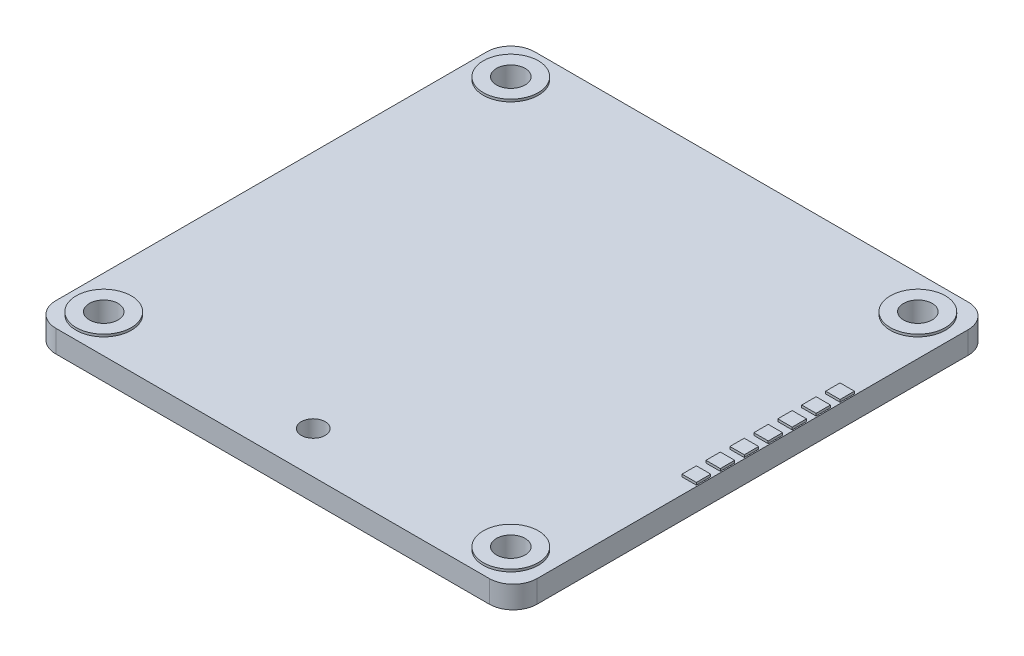
from build123d import *

# Parameters (mm, degrees)
SKETCH1_W            = 51.054
SKETCH1_H            = 50.8
BOSS_EXTRUDE1_DEPTH  = 2.3622
SKETCH5_R            = 2.921
BOSS_EXTRUDE3_DEPTH  = 0.254
SKETCH2_R            = 1.524
CUT_EXTRUDE1_DEPTH   = 73.060605776
LPATTERN1_COUNT      = 2
LPATTERN1_PITCH      = 43.18
LPATTERN1_COUNT_DIR2 = 2
LPATTERN1_PITCH_DIR2 = 43.18
FILLET1_R            = 2.54
SKETCH3_R            = 1.27
CUT_EXTRUDE2_DEPTH   = 73.060605776
SKETCH6_W            = 1.524
SKETCH6_H            = 1.524
BOSS_EXTRUDE4_DEPTH  = 0.254
LPATTERN2_COUNT      = 7
LPATTERN2_PITCH      = 2.54


with BuildPart() as part:
    # Sketch1 → Boss-Extrude1 (new body)
    with BuildSketch(Plane(origin=(0, 0, 0), x_dir=(1, 0, 0), z_dir=(0, 1, 0))):
        with Locations((25.527, 25.4)):
            Rectangle(SKETCH1_W, SKETCH1_H)
    extrude(amount=BOSS_EXTRUDE1_DEPTH)

    # Sketch5 → Boss-Extrude3 (add)
    with BuildSketch(Plane(origin=(0, 2.3622, 0), x_dir=(1, 0, 0), z_dir=(0, 1, 0))):
        with Locations(Location((3.81, 3.81, 0), (0, 0, 90))):
            Circle(SKETCH5_R)
    boss_extrude3 = extrude(amount=BOSS_EXTRUDE3_DEPTH)

    # Sketch2 → Cut-Extrude1 (cut, symmetric)
    with BuildSketch(Plane(origin=(0, 2.3622, 0), x_dir=(1, 0, 0), z_dir=(0, 1, 0))):
        with Locations(Location((3.81, 3.81, 0), (0, 0, 270))):
            Circle(SKETCH2_R)
    cut_extrude1 = extrude(amount=CUT_EXTRUDE1_DEPTH, both=True, mode=Mode.SUBTRACT)

    # LPattern1: Boss-Extrude3, Cut-Extrude1 2 × 2
    with Locations(*[(j * LPATTERN1_PITCH_DIR2, 0, -i * LPATTERN1_PITCH) for i in range(LPATTERN1_COUNT) for j in range(LPATTERN1_COUNT_DIR2) if (i, j) != (0, 0)]):
        add(boss_extrude3)
        add(cut_extrude1, mode=Mode.SUBTRACT)

    # Fillet1
    fillet1_edges = [part.edges().sort_by_distance(p)[0] for p in [
        (0, 1.1811, -50.8),
        (51.054, 1.1811, -50.8),
        (51.054, 1.1811, 0),
        (0, 1.1811, 0),
    ]]
    fillet(fillet1_edges, radius=FILLET1_R)

    # Sketch3 → Cut-Extrude2 (cut, through all)
    with BuildSketch(Plane(origin=(0, 2.3622, 0), x_dir=(1, 0, 0), z_dir=(0, 1, 0))):
        with Locations(Location((25.4, 4.443185344, 0), (0, 0, 270))):
            Circle(SKETCH3_R)
    extrude(amount=-CUT_EXTRUDE2_DEPTH, mode=Mode.SUBTRACT)

    # Sketch6 → Boss-Extrude4 (add)
    with BuildSketch(Plane(origin=(0, 2.3622, 0), x_dir=(1, 0, 0), z_dir=(0, 1, 0))):
        with Locations((50.165, 35.56)):
            Rectangle(SKETCH6_W, SKETCH6_H)
    boss_extrude4 = extrude(amount=BOSS_EXTRUDE4_DEPTH)

    # LPattern2: Boss-Extrude4 ×7
    with Locations(*[(0, 0, i * LPATTERN2_PITCH) for i in range(1, LPATTERN2_COUNT)]):
        add(boss_extrude4)


solid = part.part
